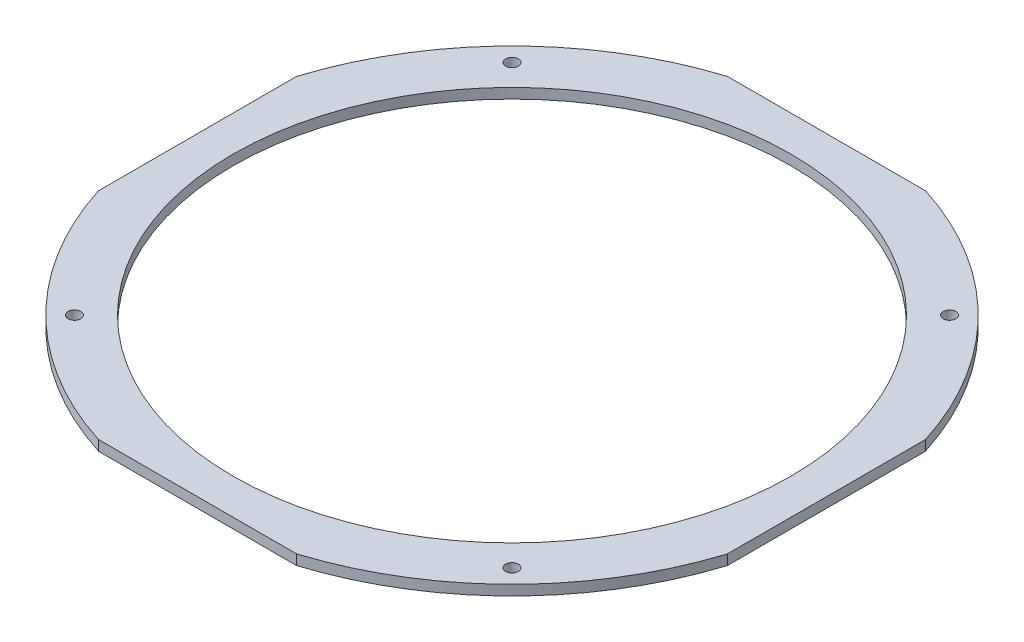
from build123d import *

# Parameters (mm, degrees)
SKETCH_1_R          = 65
SKETCH_1_R_2        = 55
EXTRUDE_1_DEPTH     = 2
SKETCH_3_W          = 168.977595328
SKETCH_3_H          = 144.759308048
SKETCH_3_W_2        = 124
SKETCH_3_H_2        = 124
CUT_EXTRUDE_1_DEPTH = 3
SKETCH_4_R          = 1.25
CUT_EXTRUDE_2_DEPTH = 3


with BuildPart() as part:
    # 草图1 → 凸台-拉伸1 (new body)
    with BuildSketch(Plane(origin=(0, 0, 0), x_dir=(1, 0, 0), z_dir=(0, 1, 0))):
        with Locations(Location((0, 0, 0), (0, 0, 270))):
            Circle(SKETCH_1_R)
        with Locations(Location((0, 0, 0), (0, 0, 270))):
            Circle(SKETCH_1_R_2, mode=Mode.SUBTRACT)
    extrude(amount=EXTRUDE_1_DEPTH)

    # 草图3 → 切除-拉伸1 (cut)
    with BuildSketch(Plane(origin=(0, 2, 0), x_dir=(1, 0, 0), z_dir=(0, 1, 0))):
        Rectangle(SKETCH_3_W, SKETCH_3_H)
        Rectangle(SKETCH_3_W_2, SKETCH_3_H_2, mode=Mode.SUBTRACT)
    extrude(amount=-CUT_EXTRUDE_1_DEPTH, mode=Mode.SUBTRACT)

    # 草图4 → 切除-拉伸2 (cut)
    with BuildSketch(Plane(origin=(0, 2, 0), x_dir=(1, 0, 0), z_dir=(0, 1, 0))):
        with Locations(Location((43.133513652, -43.133513652, 0), (0, 0, 270))):
            Circle(SKETCH_4_R)
        with Locations(Location((-43.133513652, -43.133513652, 0), (0, 0, 270))):
            Circle(SKETCH_4_R)
        with Locations(Location((-43.133513652, 43.133513652, 0), (0, 0, 270))):
            Circle(SKETCH_4_R)
        with Locations(Location((43.133513652, 43.133513652, 0), (0, 0, 270))):
            Circle(SKETCH_4_R)
    extrude(amount=-CUT_EXTRUDE_2_DEPTH, mode=Mode.SUBTRACT)


solid = part.part
